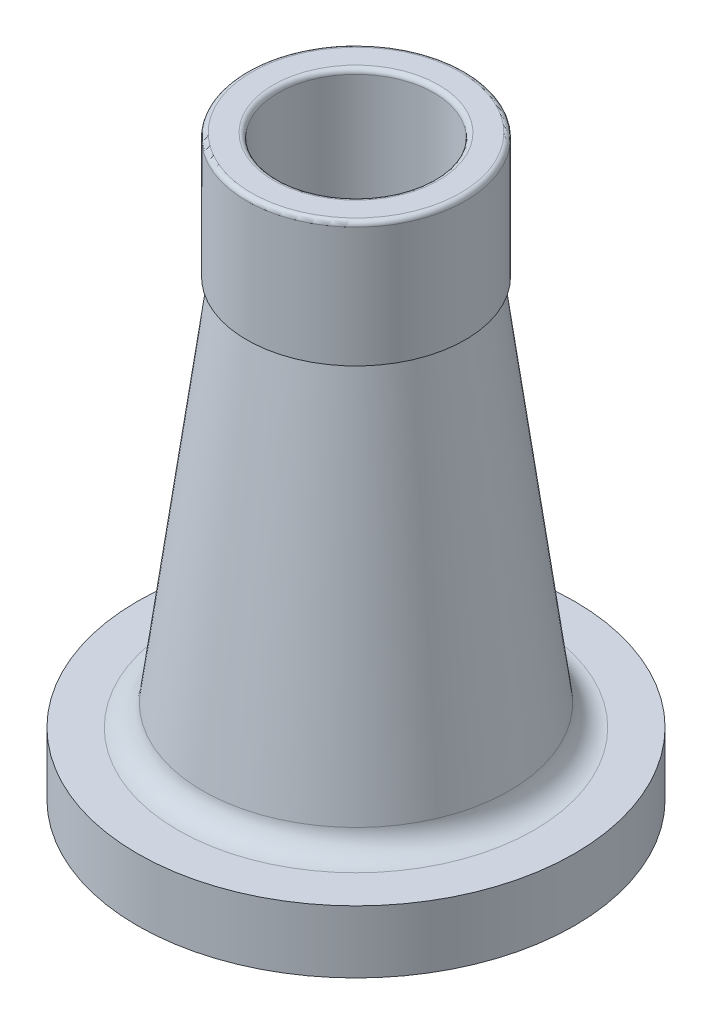
from build123d import *


with BuildPart() as part:
    # Sketch2 → 01_Body (revolve)
    with BuildSketch(Plane.XY, mode=Mode.PRIVATE) as f_01_body_sk:
        with BuildLine():
            Line((70, 0), (70, 20))
            Line((70, 20), (57.013395021, 20))
            ThreePointArc((57.013395021, 20), (51.73965579, 21.984380786), (49.082193259, 26.953081368))
            Line((49.082193259, 26.953081368), (33.5, 145))
            Line((33.5, 145), (35, 145))
            Line((35, 145), (35, 183.5))
            ThreePointArc((35, 183.5), (34.560660172, 184.560660172), (33.5, 185))
            Line((33.5, 185), (26.5, 185))
            ThreePointArc((26.5, 185), (25.439339828, 184.560660172), (25, 183.5))
            Line((25, 183.5), (25, 132.979213819))
            Line((25, 132.979213819), (42.157256224, 3))
            Line((42.157256224, 3), (47, 3))
            ThreePointArc((47, 3), (49.121320344, 2.121320344), (50, 0))
            Line((50, 0), (70, 0))
        make_face()
    revolve(f_01_body_sk.sketch.rotate(Axis((0, 0, 0), (0, 1, 0)), 90), axis=Axis((0, 0, 0), (0, 1, 0)))


solid = part.part
